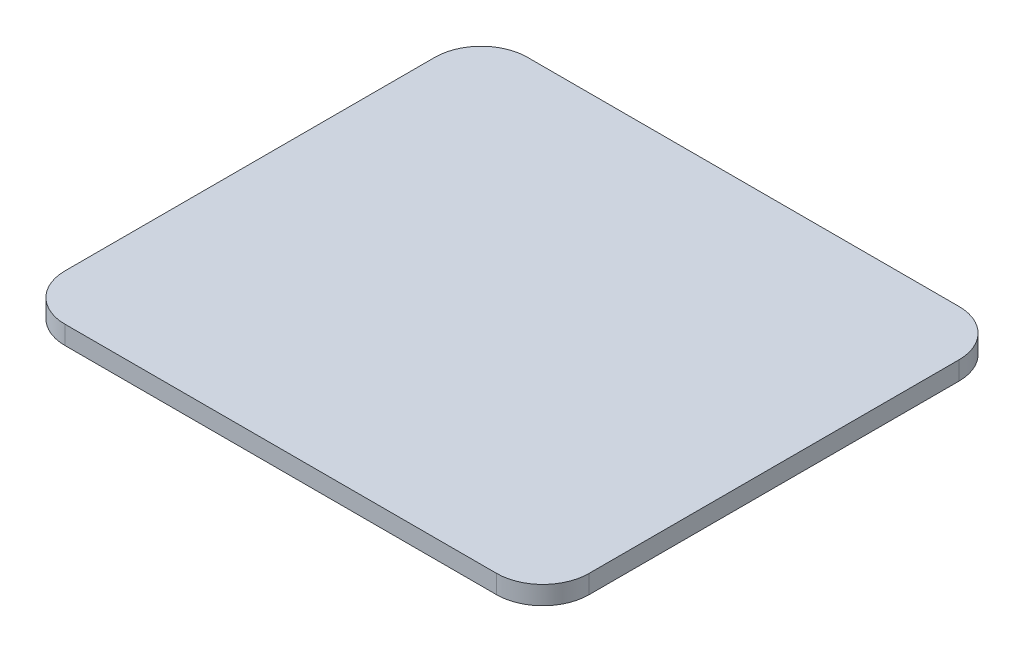
from build123d import *

# Parameters (mm, degrees)
ESBO_O1_W                = 340
ESBO_O1_H                = 300
RESSALTO_EXTRUS_O1_DEPTH = 12
FILETE1_R                = 30


with BuildPart() as part:
    # Esboço1 → Ressalto-extrusão1 (new body)
    with BuildSketch(Plane(origin=(0, 0, 0), x_dir=(1, 0, 0), z_dir=(0, 1, 0))):
        Rectangle(ESBO_O1_W, ESBO_O1_H)
    extrude(amount=RESSALTO_EXTRUS_O1_DEPTH)

    # Filete1
    filete1_edges = [part.edges().sort_by_distance(p)[0] for p in [
        (170, 6, 150),
        (-170, 6, 150),
        (-170, 6, -150),
        (170, 6, -150),
    ]]
    fillet(filete1_edges, radius=FILETE1_R)


solid = part.part
